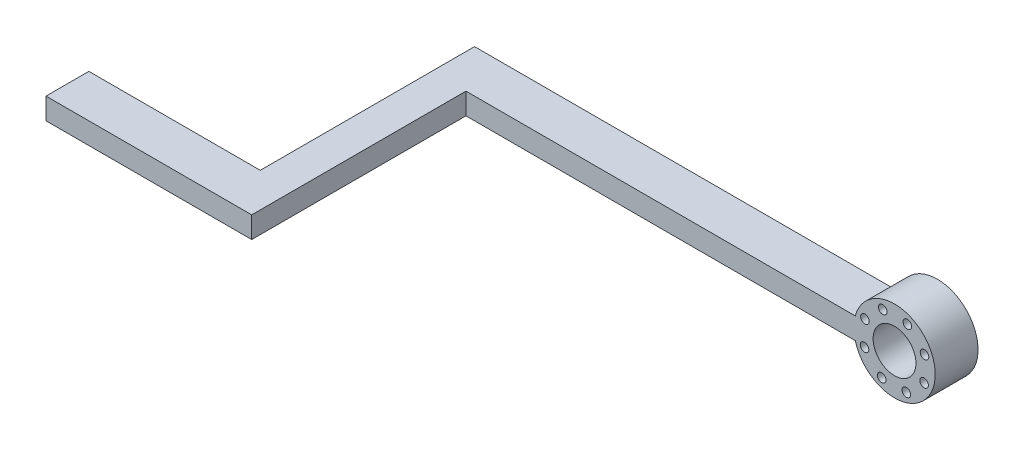
from build123d import *

# Parameters (mm, degrees)
SKETCH1_R                = 5
SKETCH1_R_2              = 1
BOSS_EXTRUDE1_DEPTH      = 10
BOSS_EXTRUDE2_DEPTH      = 40
BOSS_EXTRUDE2_DEPTH_BACK = 10
SKETCH2_W                = 8
SKETCH2_H                = 5
BOSS_EXTRUDE3_DEPTH      = 40
BOSS_EXTRUDE3_DEPTH_BACK = 8
SKETCH3_W                = 10
SKETCH3_H                = 5


with BuildPart() as part:
    # Sketch1 → Boss-Extrude1 (new body)
    with BuildSketch(Plane.XY):
        with BuildLine():
            Line((-9.16515139, 2.5), (-100, 2.5))
            Line((-100, 2.5), (-100, -2.5))
            Line((-100, -2.5), (-9.16515139, -2.5))
            ThreePointArc((-9.16515139, -2.5), (9.5, 0), (-9.16515139, 2.5))
        make_face()
        Circle(SKETCH1_R, mode=Mode.SUBTRACT)
        with Locations((2.755362887, -7)):
            Circle(SKETCH1_R_2, mode=Mode.SUBTRACT)
        with Locations((-3.001411686, -6.89808325)):
            Circle(SKETCH1_R_2, mode=Mode.SUBTRACT)
        with Locations((-7, -2.755362887)):
            Circle(SKETCH1_R_2, mode=Mode.SUBTRACT)
        with Locations((-6.89808325, 3.001411686)):
            Circle(SKETCH1_R_2, mode=Mode.SUBTRACT)
        with Locations((-2.755362887, 7)):
            Circle(SKETCH1_R_2, mode=Mode.SUBTRACT)
        with Locations((3.001411686, 6.89808325)):
            Circle(SKETCH1_R_2, mode=Mode.SUBTRACT)
        with Locations((7, 2.755362887)):
            Circle(SKETCH1_R_2, mode=Mode.SUBTRACT)
        with Locations((6.89808325, -3.001411686)):
            Circle(SKETCH1_R_2, mode=Mode.SUBTRACT)
    extrude(amount=BOSS_EXTRUDE1_DEPTH)

    # Sketch2 → Boss-Extrude2 (add, two sides: drawn at the far end of the back side and taken through both)
    with BuildSketch(Plane.XY.offset(10).offset(-BOSS_EXTRUDE2_DEPTH_BACK)):
        with Locations((-104, 0)):
            Rectangle(SKETCH2_W, SKETCH2_H)
    extrude(amount=BOSS_EXTRUDE2_DEPTH + BOSS_EXTRUDE2_DEPTH_BACK)

    # Sketch3 → Boss-Extrude3 (add, two sides: drawn at the far end of the back side and taken through both)
    with BuildSketch(Plane.ZY.offset(108).offset(-BOSS_EXTRUDE3_DEPTH_BACK)):
        with Locations((55, 0)):
            Rectangle(SKETCH3_W, SKETCH3_H)
    extrude(amount=BOSS_EXTRUDE3_DEPTH + BOSS_EXTRUDE3_DEPTH_BACK)


solid = part.part
